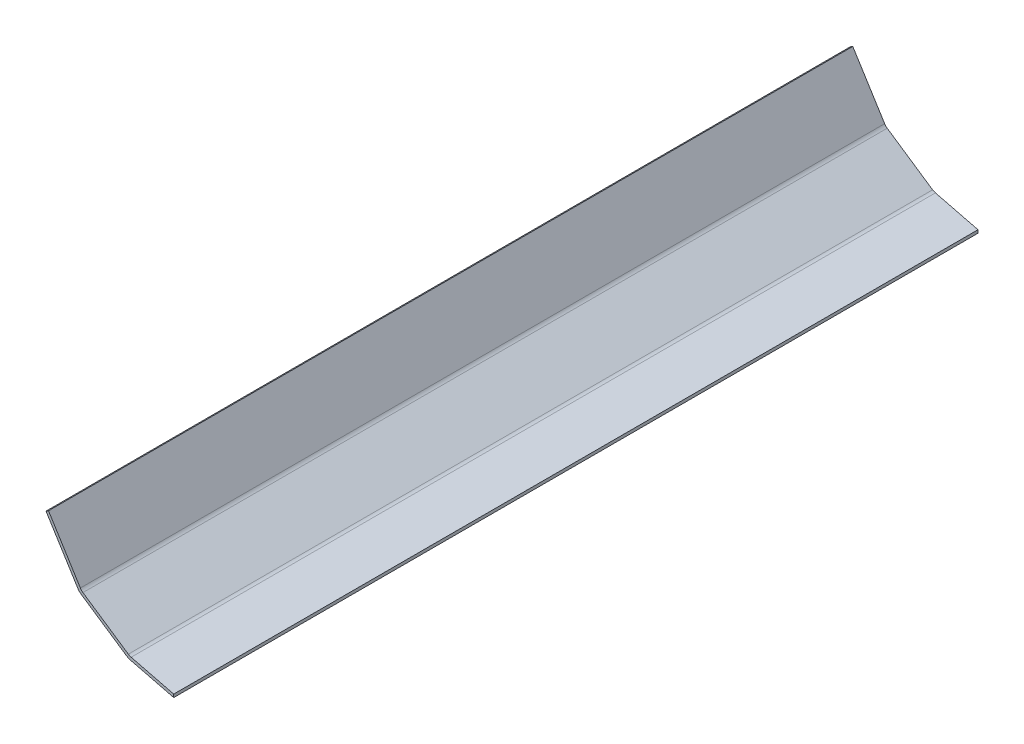
from build123d import *

# Parameters (mm, degrees)
NESTED_SUPPORT_SKIN_BEHIND_TOE_DEPTH = 272


with BuildPart() as part:
    # Nested support skin behind toe profile → Nested support skin behind toe (new body)
    with BuildSketch(Plane.XY):
        with BuildLine():
            Line((135.5, 3.091362383), (121.100256736, 6.681621613))
            ThreePointArc((121.100256736, 6.681621613), (120.605812494, 6.851872419), (120.148443712, 7.105396074))
            Line((120.148443712, 7.105396074), (104.793241848, 17.462610509))
            ThreePointArc((104.793241848, 17.462610509), (104.312801158, 17.865748115), (103.92667627, 18.359965434))
            Line((103.92667627, 18.359965434), (93.151951904, 35.603128879))
            Line((93.151951904, 35.603128879), (92.303903808, 35.073209614))
            Line((92.303903808, 35.073209614), (103.078628174, 17.83004617))
            ThreePointArc((103.078628174, 17.83004617), (103.593461357, 17.171089745), (104.234048945, 16.633572937))
            Line((104.234048945, 16.633572937), (119.589250809, 6.276358502))
            ThreePointArc((119.589250809, 6.276358502), (120.19907585, 5.938326962), (120.85833484, 5.711325887))
            Line((120.85833484, 5.711325887), (135.5, 2.060748754))
            Line((135.5, 2.060748754), (135.5, 3.091362383))
        make_face()
    extrude(amount=NESTED_SUPPORT_SKIN_BEHIND_TOE_DEPTH)


solid = part.part
